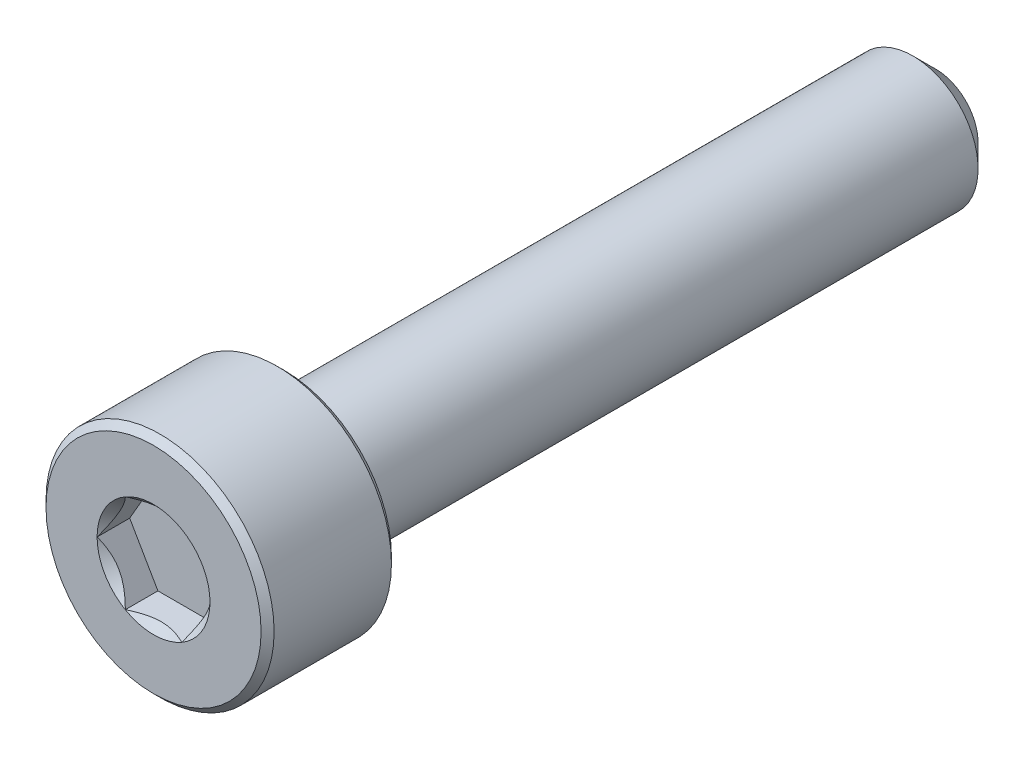
from build123d import *

# Parameters (mm, degrees)
CUT_EXTRUDE1_DEPTH = 1
SKETCH4_R          = 1.732050808
CUT_EXTRUDE2_DEPTH = 0.5
CUT_EXTRUDE2_DRAFT = -45


with BuildPart() as part:
    # Sketch2 → Revolve1 (revolve)
    with BuildSketch(Plane(origin=(0, 0, 0), x_dir=(0, 0, -1), z_dir=(1, 0, 0)), mode=Mode.PRIVATE) as revolve1_sk:
        Polygon((-11.8, 3.5), (-8.2, 3.5), (-8, 3.3), (-8, 2), (11.3, 2), (12, 1.3), (12, 0), (-12, 0), (-12, 3.3), align=None)
    revolve(revolve1_sk.sketch.rotate(Axis((0, 0, -12), (0, 0, 1)), 90), axis=Axis((0, 0, -12), (0, 0, 1)))

    # Sketch3 → Cut-Extrude1 (cut)
    with BuildSketch(Plane.XY.offset(12)):
        Polygon((0.866025404, 1.5), (-0.866025404, 1.5), (-1.732050808, 0), (-0.866025404, -1.5), (0.866025404, -1.5), (1.732050808, 0), align=None)
    extrude(amount=-CUT_EXTRUDE1_DEPTH, mode=Mode.SUBTRACT)


with BuildPart() as cut_extrude2_tool:
    # Sketch4 → Cut-Extrude2 (with draft: the straight prism first)
    with BuildSketch(Plane.XY.offset(12)):
        Circle(SKETCH4_R)
    extrude(amount=-CUT_EXTRUDE2_DEPTH)
    # Cut-Extrude2: the draft: its side faces are tilted about the plane it starts from
    cut_extrude2_sides = [cut_extrude2_tool.faces().sort_by_distance(p)[0] for p in [
        (-1.732050808, 0, 11.75),
    ]]
    draft(cut_extrude2_sides, Plane.XY.offset(12), CUT_EXTRUDE2_DRAFT)


with BuildPart() as part_1:
    add(part.part)

    # Cut-Extrude2: cut by cut_extrude2_tool
    add(cut_extrude2_tool.part, mode=Mode.SUBTRACT)


solid = part_1.part
